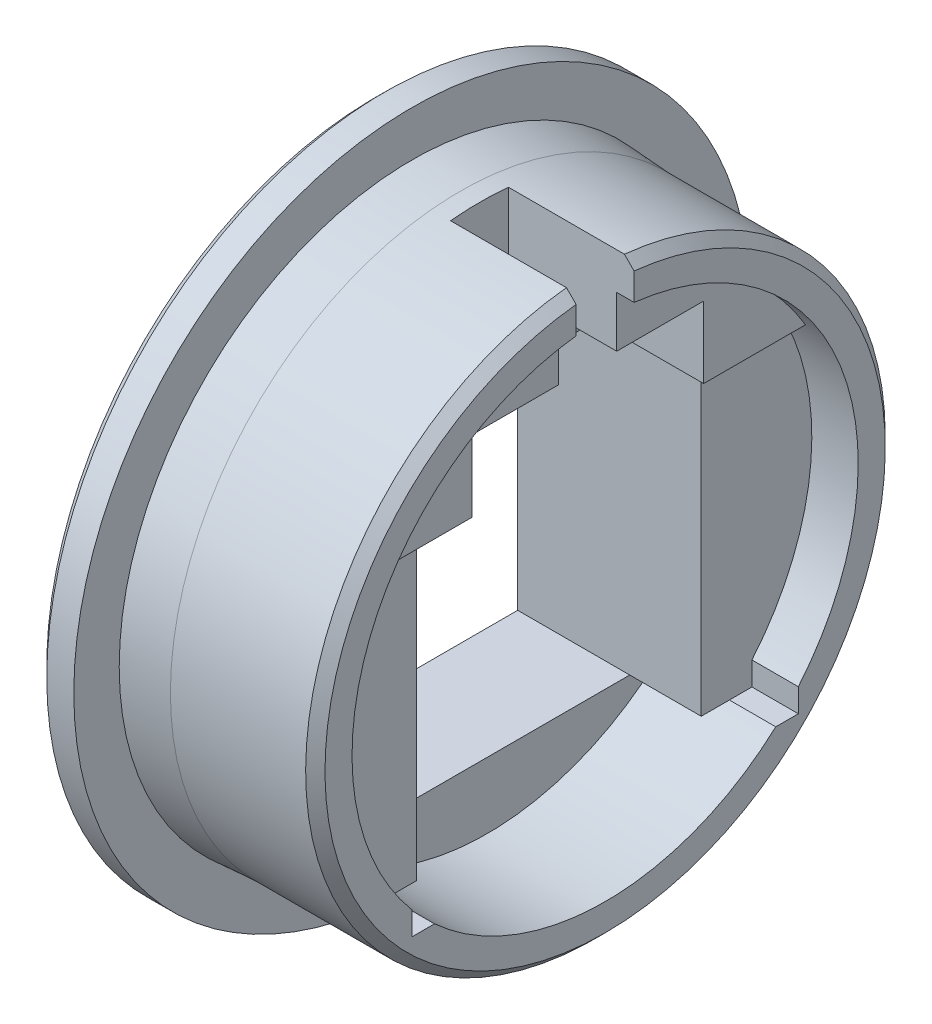
from build123d import *

# Parameters (mm, degrees)
SKIZZE2_W                       = 14.75
SKIZZE2_H                       = 16.35
SCHNITT_LINEAR_AUSTRAGEN1_DEPTH = 28.461063344
AUFSATZ_LINEAR_AUSTRAGEN1_DEPTH = 3.9
AUFSATZ_LINEAR_AUSTRAGEN2_DEPTH = 9.1
SCHNITT_LINEAR_AUSTRAGEN2_DEPTH = 6
AUFSATZ_LINEAR_AUSTRAGEN3_DEPTH = 7.6
FASE1_SIZE                      = 0.5
SCHNITT_LINEAR_AUSTRAGEN3_DEPTH = 0.4
SCHNITT_LINEAR_AUSTRAGEN4_REACH = 29.461
SKIZZE13_W                      = 20
SKIZZE13_H                      = 1.212730801
SCHNITT_LINEAR_AUSTRAGEN6_DEPTH = 2.4


with BuildPart() as part:
    # Skizze1 → Rotation1 (revolve)
    with BuildSketch(Plane(origin=(0, 0, 0), x_dir=(1, 0, 0), z_dir=(0, 1, 0)), mode=Mode.PRIVATE) as rotation1_sk:
        Polygon((0, 0), (0, 17.5), (1.9, 17.5), (1.9, 15), (11.9, 15), (11.9, 13.1), (1.9, 13.1), (1.9, 0), align=None)
    revolve(rotation1_sk.sketch.rotate(Axis((-3.369811321, 0, 0), (1, 0, 0)), 180), axis=Axis((-3.369811321, 0, 0), (1, 0, 0)))

    # Skizze2 → Schnitt-Linear austragen1 (cut, through all)
    with BuildSketch(Plane.ZY):
        with Locations((0, -1.5)):
            Rectangle(SKIZZE2_W, SKIZZE2_H)
    extrude(amount=-SCHNITT_LINEAR_AUSTRAGEN1_DEPTH, mode=Mode.SUBTRACT)

    # Skizze3 → Aufsatz-Linear austragen1 (add)
    with BuildSketch(Plane(origin=(1.9, 0, 0), x_dir=(0, 0, -1), z_dir=(1, 0, 0))):
        with BuildLine():
            Line((-8.832008548, -9.675), (8.832008548, -9.675))
            ThreePointArc((8.832008548, -9.675), (0, -13.1), (-8.832008548, -9.675))
        make_face()
    extrude(amount=AUFSATZ_LINEAR_AUSTRAGEN1_DEPTH)

    # Skizze4 → Aufsatz-Linear austragen2 (add)
    with BuildSketch(Plane(origin=(1.9, 0, 0), x_dir=(0, 0, -1), z_dir=(1, 0, 0))):
        with BuildLine():
            Line((-11.271839912, 6.675), (11.271839912, 6.675))
            ThreePointArc((11.271839912, 6.675), (0, 13.1), (-11.271839912, 6.675))
        make_face()
    extrude(amount=AUFSATZ_LINEAR_AUSTRAGEN2_DEPTH)

    # Skizze6 → Schnitt-Linear austragen2 (cut, symmetric)
    with BuildSketch(Plane.XY):
        Polygon((5.4, 6.675), (5.4, 11.625), (8.5, 11.625), (8.5, 10.375), (11, 10.375), (11, 6.675), align=None)
    extrude(amount=SCHNITT_LINEAR_AUSTRAGEN2_DEPTH, both=True, mode=Mode.SUBTRACT)

    # Skizze7 → Aufsatz-Linear austragen3 (add)
    with BuildSketch(Plane(origin=(1.9, 0, 0), x_dir=(0, 0, -1), z_dir=(1, 0, 0))):
        with BuildLine():
            Line((-11.271839912, 6.675), (-7.375, 6.675))
            Line((-7.375, 6.675), (-7.375, -9.675))
            Line((-7.375, -9.675), (-8.832008548, -9.675))
            ThreePointArc((-8.832008548, -9.675), (-12.956535252, -1.933441044), (-11.271839912, 6.675))
        make_face()
        with BuildLine():
            Line((7.375, 6.675), (7.375, -9.675))
            Line((7.375, -9.675), (8.832008548, -9.675))
            ThreePointArc((8.832008548, -9.675), (12.956535252, -1.933441044), (11.271839912, 6.675))
            Line((11.271839912, 6.675), (7.375, 6.675))
        make_face()
    extrude(amount=AUFSATZ_LINEAR_AUSTRAGEN3_DEPTH)

    # Fase1
    fase1_edges = [part.edges().sort_by_distance(p)[0] for p in [
        (11.9, 0, -15),
        (0, 0, -17.5),
    ]]
    chamfer(fase1_edges, length=FASE1_SIZE)

    # Skizze8 → Schnitt-Linear austragen3 (cut)
    # profile 1 of 3: a face of its own
    with BuildSketch(Plane.ZY):
        Polygon((-6.298076923, 14.175), (-5.400641026, 14.175), (-5.400641026, 10.072435897), (-3.990384615, 10.072435897), (-3.990384615, 9.175), (-6.298076923, 9.175), align=None)
    # profile 2 of 3: a face of its own
    with BuildSketch(Plane.ZY):
        Polygon((-1.681690705, 14.175), (-0.849358974, 14.175), (1.169871795, 9.175), (0.211338141, 9.175), (-0.177283654, 10.200641026), (-2.355769231, 10.200641026), (-2.744391026, 9.175), (-3.701923077, 9.175), align=None)
        Polygon((-1.266025641, 12.833854167), (-2.015224359, 11.098076923), (-0.516826923, 11.098076923), align=None, mode=Mode.SUBTRACT)
    # profile 3 of 3: a face of its own
    with BuildSketch(Plane.ZY):
        Polygon((1.907051282, 14.175), (2.715344551, 14.175), (4.983974359, 10.884735577), (4.983974359, 14.175), (5.881410256, 14.175), (5.881410256, 9.175), (5.067107372, 9.175), (2.804487179, 12.455248397), (2.804487179, 9.175), (1.907051282, 9.175), align=None)
    extrude(amount=-SCHNITT_LINEAR_AUSTRAGEN3_DEPTH, mode=Mode.SUBTRACT)

    # Schnitt-Linear austragen4: up to this face of the body (flat: up to its plane)
    schnitt_linear_austragen4_end = Plane(part.part.faces().sort_by_distance((5.4, 9.15, 0))[0])
    # Skizze10 → Schnitt-Linear austragen4 (cut, up to the picked face)
    with BuildSketch(Plane(origin=(11.9, 0, 0), x_dir=(0, 0, -1), z_dir=(1, 0, 0)), mode=Mode.PRIVATE) as schnitt_linear_austragen4_sk1:
        with BuildLine():
            Line((-1.5, 10.375), (-1.5, 14.924811557))
            ThreePointArc((-1.5, 14.924811557), (0, 15), (1.5, 14.924811557))
            Line((1.5, 14.924811557), (1.5, 10.375))
            Line((1.5, 10.375), (-1.5, 10.375))
        make_face()
    schnitt_linear_austragen4_tool1 = split(extrude(schnitt_linear_austragen4_sk1.sketch, amount=-SCHNITT_LINEAR_AUSTRAGEN4_REACH, mode=Mode.PRIVATE), bisect_by=schnitt_linear_austragen4_end, keep=Keep.BOTH, mode=Mode.PRIVATE)
    add(schnitt_linear_austragen4_tool1.solids().sort_by(Axis((11.9, 12.675036, 0), (-1, 0, 0)))[0], mode=Mode.SUBTRACT)

    # Skizze13 → Schnitt-Linear austragen6 (cut)
    with BuildSketch(Plane(origin=(11.9, 0, 0), x_dir=(0, 0, -1), z_dir=(1, 0, 0))):
        with Locations((0, -9.0686346)):
            Rectangle(SKIZZE13_W, SKIZZE13_H)
    extrude(amount=-SCHNITT_LINEAR_AUSTRAGEN6_DEPTH, mode=Mode.SUBTRACT)

    # Skizze14 → Rotation2 (revolve)
    with BuildSketch(Plane.XY, mode=Mode.PRIVATE) as rotation2_sk:
        Polygon((4.4, 15), (1.9, 15.15), (1.9, 15), align=None)
    revolve(rotation2_sk.sketch.rotate(Axis((-3.369811321, 0, 0), (-1, 0, 0)), 90), axis=Axis((-3.369811321, 0, 0), (-1, 0, 0)))


solid = part.part
